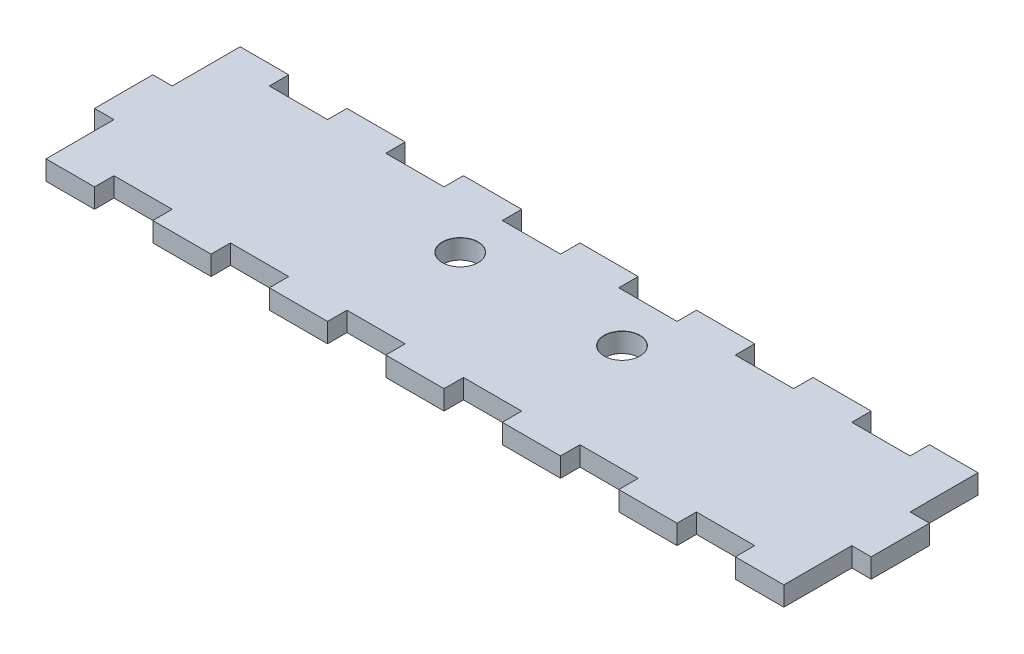
from build123d import *

# Parameters (mm, degrees)
BOSS_EXTRUDE1_DEPTH            = 1.5
M5_CLEARANCE_HOLE1_D           = 5.5
M5_CLEARANCE_HOLE1_CSINK_D     = 5.55
M5_CLEARANCE_HOLE1_CSINK_ANGLE = 90


with BuildPart() as part:
    # Sketch1 → Boss-Extrude1 (new, symmetric)
    with BuildSketch(Plane(origin=(0, 0, 0), x_dir=(1, 0, 0), z_dir=(0, 1, 0))):
        Polygon((57, 15), (49.5, 15), (49.5, 12), (40.5, 12), (40.5, 15), (31.5, 15), (31.5, 12), (22.5, 12), (22.5, 15), (13.5, 15), (13.5, 12), (4.5, 12), (4.5, 15), (-4.5, 15), (-4.5, 12), (-13.5, 12), (-13.5, 15), (-22.5, 15), (-22.5, 12), (-31.5, 12), (-31.5, 15), (-40.5, 15), (-40.5, 12), (-49.5, 12), (-49.5, 15), (-57, 15), (-57, 12), (-57, 4.5), (-60, 4.5), (-60, -4.5), (-57, -4.5), (-57, -12), (-57, -15), (-49.5, -15), (-49.5, -12), (-40.5, -12), (-40.5, -15), (-31.5, -15), (-31.5, -12), (-22.5, -12), (-22.5, -15), (-13.5, -15), (-13.5, -12), (-4.5, -12), (-4.5, -15), (4.5, -15), (4.5, -12), (13.5, -12), (13.5, -15), (22.5, -15), (22.5, -12), (31.5, -12), (31.5, -15), (40.5, -15), (40.5, -12), (49.5, -12), (49.5, -15), (57, -15), (57, -12), (57, -4.5), (60, -4.5), (60, 4.5), (57, 4.5), (57, 12), align=None)
    extrude(amount=BOSS_EXTRUDE1_DEPTH, both=True)

    # M5 Clearance Hole1 (through all)
    with Locations(Plane(origin=(0, 1.5, 0), x_dir=(1, 0, 0), z_dir=(0, 1, 0))):
        with Locations((-12.5, 4.5), (12.5, 4.5)):
            CounterSinkHole(M5_CLEARANCE_HOLE1_D / 2, M5_CLEARANCE_HOLE1_CSINK_D / 2, counter_sink_angle=M5_CLEARANCE_HOLE1_CSINK_ANGLE)


solid = part.part
